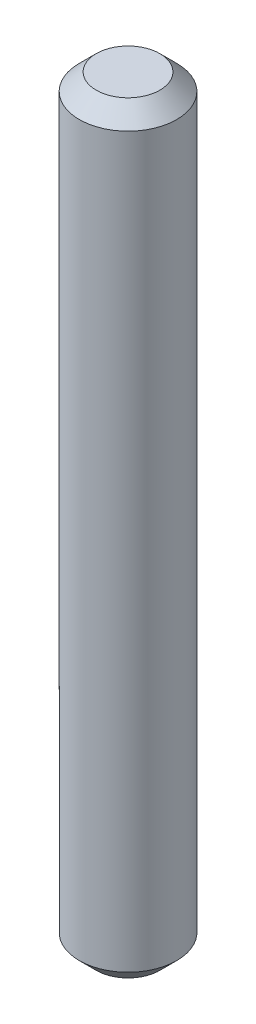
from build123d import *

# Parameters (mm, degrees)
SKETCH1_R           = 2.875
BOSS_EXTRUDE1_DEPTH = 22.5
CHAMFER1_SIZE       = 1


with BuildPart() as part:
    # Sketch1 → Boss-Extrude1 (new, symmetric)
    with BuildSketch(Plane(origin=(0, 0, 0), x_dir=(1, 0, 0), z_dir=(0, 1, 0))):
        with Locations(Location((0, 0, 0), (0, 0, 90))):
            Circle(SKETCH1_R)
    extrude(amount=BOSS_EXTRUDE1_DEPTH, both=True)

    # Chamfer1
    chamfer1_edges = [part.edges().sort_by_distance(p)[0] for p in [
        (0, -22.5, 2.875),
        (0, 22.5, 2.875),
    ]]
    chamfer(chamfer1_edges, length=CHAMFER1_SIZE)


solid = part.part
